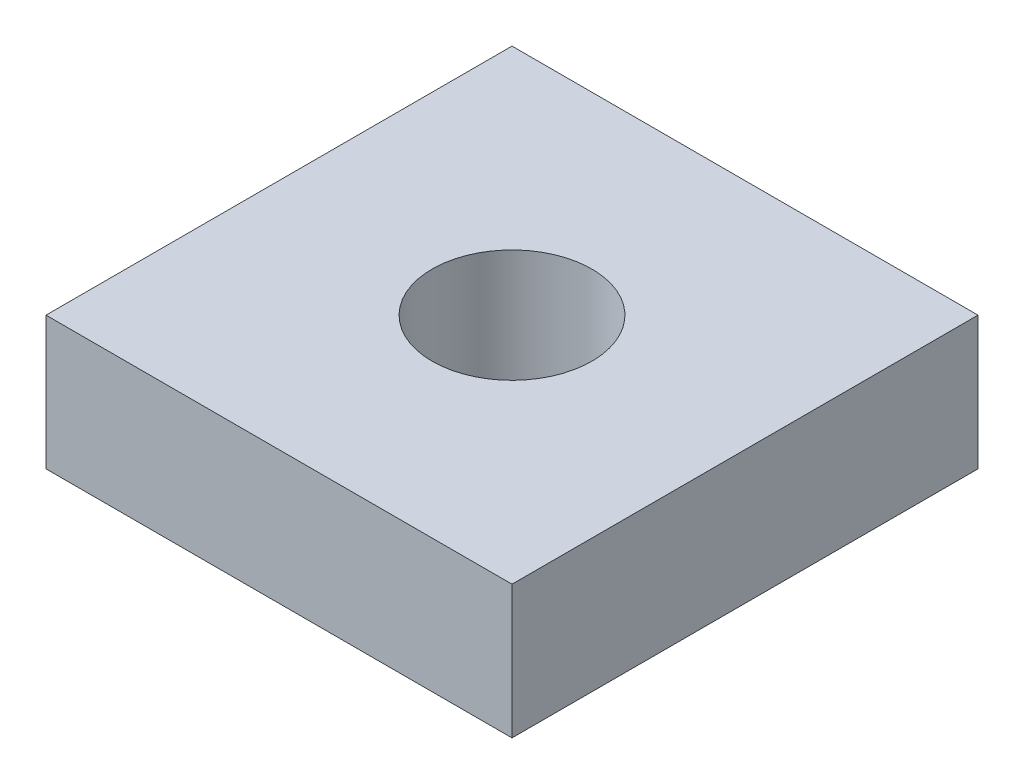
from build123d import *

# Parameters (mm, degrees)
SKETCH1_W           = 35
SKETCH1_H           = 35
SKETCH1_R           = 6
BOSS_EXTRUDE1_DEPTH = 10


with BuildPart() as part:
    # Sketch1 → Boss-Extrude1 (new body)
    with BuildSketch(Plane(origin=(0, 0, 0), x_dir=(1, 0, 0), z_dir=(0, 1, 0))):
        Rectangle(SKETCH1_W, SKETCH1_H)
        with Locations(Location((0, 0, 0), (0, 0, 270))):
            Circle(SKETCH1_R, mode=Mode.SUBTRACT)
    extrude(amount=BOSS_EXTRUDE1_DEPTH)


solid = part.part
